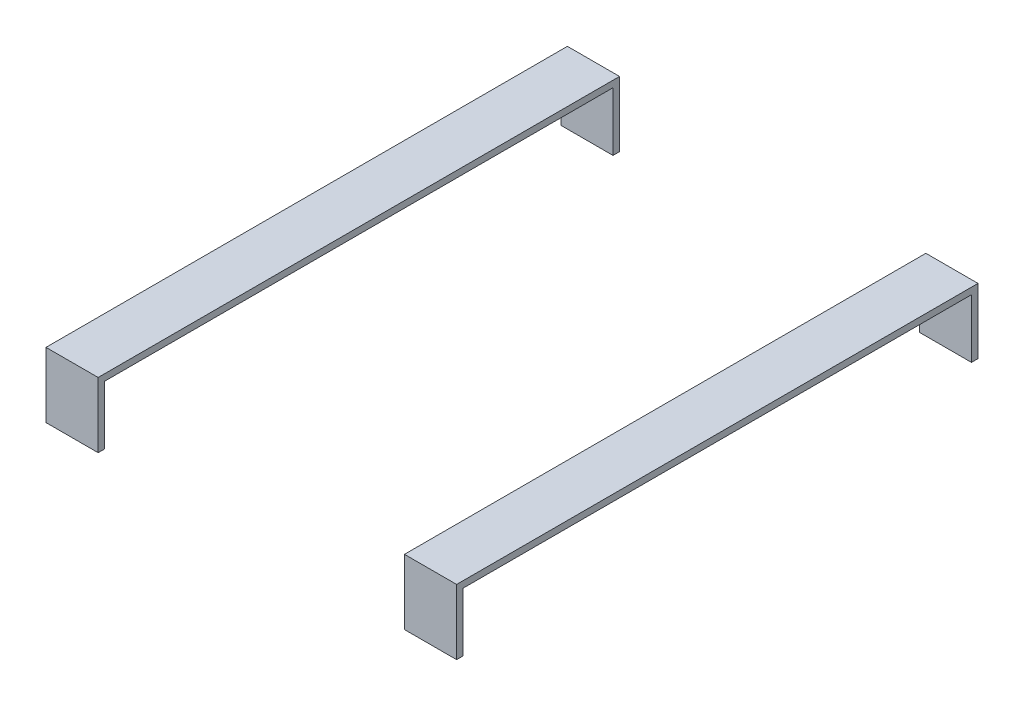
from build123d import *

# Parameters (mm, degrees)
CROQUIS1_W                = 80
CROQUIS1_H                = 10
SALIENTE_EXTRUIR1_DEPTH   = 100
SALIENTE_EXTRUIR1_2_DEPTH = 100
SALIENTE_EXTRUIR1_3_DEPTH = 100
SALIENTE_EXTRUIR1_4_DEPTH = 100
CROQUIS2_W                = 80
CROQUIS2_H                = 10
SALIENTE_EXTRUIR2_DEPTH   = 780


with BuildPart() as part:
    # Croquis1 → Saliente-Extruir1 (new body)
    with BuildSketch(Plane(origin=(0, 0, 0), x_dir=(1, 0, 0), z_dir=(0, 1, 0))):
        with Locations((-40, -5)):
            Rectangle(CROQUIS1_W, CROQUIS1_H)
    extrude(amount=SALIENTE_EXTRUIR1_DEPTH)



with BuildPart() as body_2:
    # Croquis1 → Saliente-Extruir1 2 (new body)
    with BuildSketch(Plane(origin=(0, 0, 0), x_dir=(1, 0, 0), z_dir=(0, 1, 0))):
        with Locations((510, -5)):
            Rectangle(CROQUIS1_W, CROQUIS1_H)
    extrude(amount=SALIENTE_EXTRUIR1_2_DEPTH)


with BuildPart() as body_3:
    # Croquis1 → Saliente-Extruir1 3 (new body)
    with BuildSketch(Plane(origin=(0, 0, 0), x_dir=(1, 0, 0), z_dir=(0, 1, 0))):
        with Locations((510, -795)):
            Rectangle(CROQUIS1_W, CROQUIS1_H)
    extrude(amount=SALIENTE_EXTRUIR1_3_DEPTH)


with BuildPart() as body_4:
    # Croquis1 → Saliente-Extruir1 4 (new body)
    with BuildSketch(Plane(origin=(0, 0, 0), x_dir=(1, 0, 0), z_dir=(0, 1, 0))):
        with Locations((-40, -795)):
            Rectangle(CROQUIS1_W, CROQUIS1_H)
    extrude(amount=SALIENTE_EXTRUIR1_4_DEPTH)


with BuildPart() as part_1:
    add(part.part)

    add(body_2.part)  # Saliente-Extruir2 merges body 2

    add(body_3.part)  # Saliente-Extruir2 merges body 3

    add(body_4.part)  # Saliente-Extruir2 merges body 4
    # Croquis2 → Saliente-Extruir2 (add)
    with BuildSketch(Plane.XY.offset(10)):
        with Locations((-40, 95)):
            Rectangle(CROQUIS2_W, CROQUIS2_H)
        with Locations((510, 95)):
            Rectangle(CROQUIS2_W, CROQUIS2_H)
    extrude(amount=SALIENTE_EXTRUIR2_DEPTH)


solid = part_1.part
